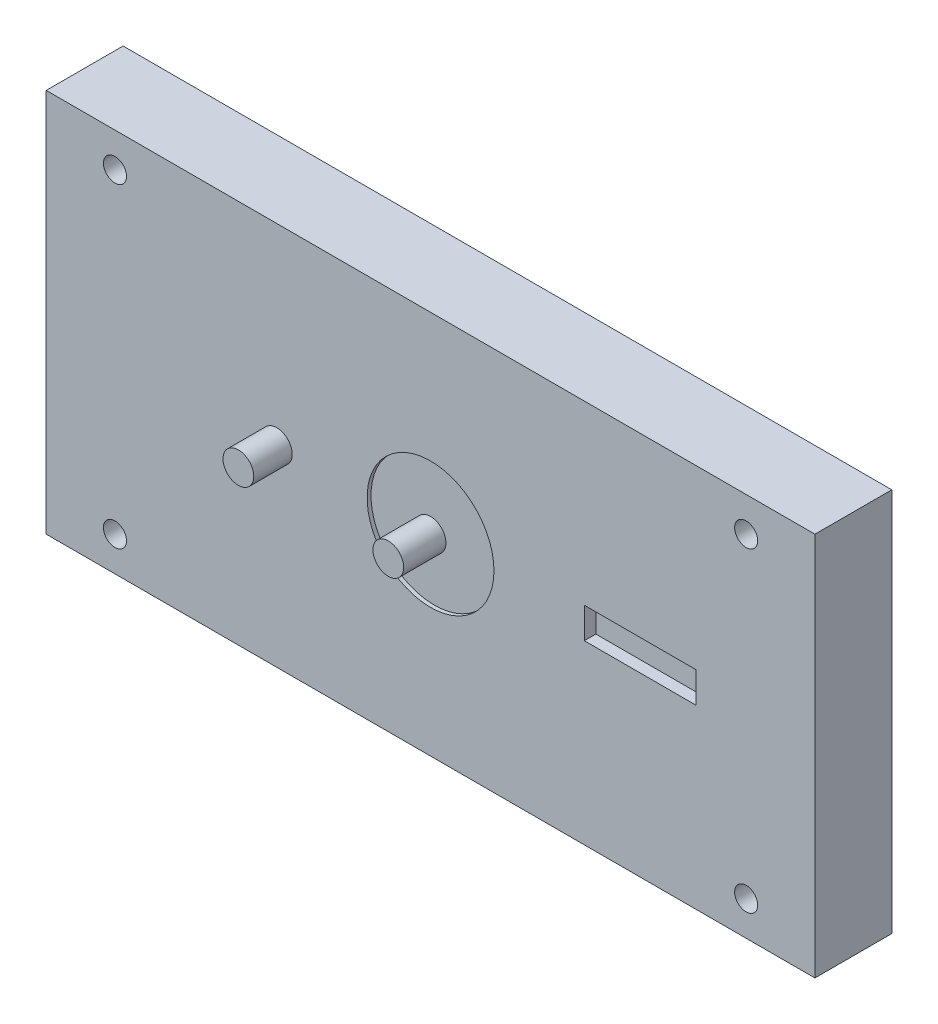
from build123d import *

# Parameters (mm, degrees)
SKETCH_1_W          = 200
SKETCH_1_H          = 100
EXTRUDE_1_DEPTH     = 20
SKETCH_2_R          = 16.5
CUT_EXTRUDE_1_DEPTH = 1
CUT_EXTRUDE_2_DEPTH = 3
SKETCH_4_R          = 3
CUT_EXTRUDE_4_DEPTH = 20
SKETCH_5_R          = 3
CUT_EXTRUDE_5_DEPTH = 20
SKETCH_6_R          = 4
EXTRUDE_3_DEPTH     = 11
SKETCH_7_R          = 4
EXTRUDE_4_DEPTH     = 10


with BuildPart() as part:
    # 草图1 → 凸台-拉伸1 (new body)
    with BuildSketch(Plane.XY):
        with Locations((100, 50)):
            Rectangle(SKETCH_1_W, SKETCH_1_H)
    extrude(amount=-EXTRUDE_1_DEPTH)

    # 草图2 → 切除-拉伸1 (cut)
    with BuildSketch(Plane.XY):
        with Locations((100, 50)):
            Circle(SKETCH_2_R)
    extrude(amount=-CUT_EXTRUDE_1_DEPTH, mode=Mode.SUBTRACT)

    # 草图3 → 切除-拉伸2 (cut)
    with BuildSketch(Plane.XY):
        Polygon((140, 54), (140, 50), (140, 46), (169, 46), (169, 54), align=None)
    extrude(amount=-CUT_EXTRUDE_2_DEPTH, mode=Mode.SUBTRACT)

    # 草图4 → 切除-拉伸4 (cut)
    with BuildSketch(Plane.XY):
        with Locations((17.88854382, 91.05572809)):
            Circle(SKETCH_4_R)
        with Locations((182.11145618, 91.05572809)):
            Circle(SKETCH_4_R)
    extrude(amount=-CUT_EXTRUDE_4_DEPTH, mode=Mode.SUBTRACT)

    # 草图5 → 切除-拉伸5 (cut)
    with BuildSketch(Plane.XY):
        with Locations((17.88854382, 8.94427191)):
            Circle(SKETCH_5_R)
        with Locations((182.11145618, 8.94427191)):
            Circle(SKETCH_5_R)
    extrude(amount=-CUT_EXTRUDE_5_DEPTH, mode=Mode.SUBTRACT)

    # 草图7 → 凸台-拉伸4 (add)
    with BuildSketch(Plane.XY):
        with Locations((60, 50)):
            Circle(SKETCH_7_R)
    extrude(amount=EXTRUDE_4_DEPTH)


with BuildPart() as body_2:
    # 草图6 → 凸台-拉伸3 (new body)
    with BuildSketch(Plane.XY):
        with Locations((100, 50)):
            Circle(SKETCH_6_R)
    extrude(amount=EXTRUDE_3_DEPTH)


solid = Compound([part.part, body_2.part])
